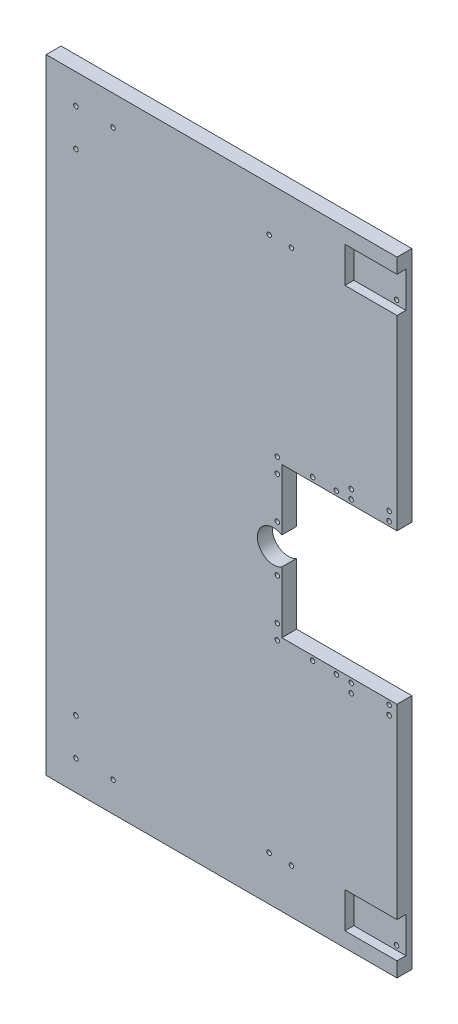
from build123d import *

# Parameters (mm, degrees)
EXTRUDE_1_DEPTH     = 10
SKETCH_2_R          = 1.5
CUT_EXTRUDE_1_DEPTH = 10
SKETCH_3_R          = 1.5
CUT_EXTRUDE_2_DEPTH = 10
SKETCH_4_R          = 1.5
CUT_EXTRUDE_3_DEPTH = 10
SKETCH_5_W          = 35
SKETCH_5_H          = 24
CUT_EXTRUDE_4_DEPTH = 6
SKETCH_6_R          = 1.5
CUT_EXTRUDE_5_DEPTH = 241.956427596


with BuildPart() as part:
    # 草图1 → 凸台-拉伸1 (new body)
    with BuildSketch(Plane.XY):
        with BuildLine():
            Line((118, 210), (-118, 210))
            Line((-118, 210), (-118, -210))
            Line((-118, -210), (118, -210))
            Line((118, -210), (118, -50.5))
            Line((118, -50.5), (40.5, -50.5))
            Line((40.5, -50.5), (40.5, -9.334147293))
            ThreePointArc((40.5, -9.334147293), (24.099506706, 0), (40.5, 9.334147293))
            Line((40.5, 9.334147293), (40.5, 50.5))
            Line((40.5, 50.5), (118, 50.5))
            Line((118, 50.5), (118, 210))
        make_face()
    extrude(amount=EXTRUDE_1_DEPTH)

    # 草图2 → 切除-拉伸1 (cut)
    with BuildSketch(Plane.XY.offset(10)):
        with Locations((-98, 165)):
            Circle(SKETCH_2_R)
        with Locations((-73, 190)):
            Circle(SKETCH_2_R)
        with Locations((-98, 190)):
            Circle(SKETCH_2_R)
    cut_extrude_1 = extrude(amount=-CUT_EXTRUDE_1_DEPTH, mode=Mode.SUBTRACT)

    # 草图3 → 切除-拉伸2 (cut)
    with BuildSketch(Plane.XY.offset(10)):
        with Locations((37.5, -15.672792958)):
            Circle(SKETCH_3_R)
        with Locations((112.73, -53.5)):
            Circle(SKETCH_3_R)
        with Locations((112.73, -59.5)):
            Circle(SKETCH_3_R)
        with Locations((87.23, -53.5)):
            Circle(SKETCH_3_R)
        with Locations((87.23, -59.5)):
            Circle(SKETCH_3_R)
        with Locations((77.23, -53.5)):
            Circle(SKETCH_3_R)
        with Locations((61.23, -53.5)):
            Circle(SKETCH_3_R)
        with Locations((37.5, -53.5)):
            Circle(SKETCH_3_R)
        with Locations((37.5, -43.5)):
            Circle(SKETCH_3_R)
    cut_extrude_2 = extrude(amount=-CUT_EXTRUDE_2_DEPTH, mode=Mode.SUBTRACT)

    # 镜向1: 切除-拉伸2 across plane
    add(cut_extrude_2.mirror(Plane.ZX), mode=Mode.SUBTRACT)

    # 镜向2: 切除-拉伸1 across plane
    add(cut_extrude_1.mirror(Plane.ZX), mode=Mode.SUBTRACT)

    # 草图4 → 切除-拉伸3 (cut)
    with BuildSketch(Plane.XY.offset(10)):
        with Locations((32, 180)):
            Circle(SKETCH_4_R)
        with Locations((47, 180)):
            Circle(SKETCH_4_R)
    cut_extrude_3 = extrude(amount=-CUT_EXTRUDE_3_DEPTH, mode=Mode.SUBTRACT)

    # 镜向3: 切除-拉伸3 across plane
    add(cut_extrude_3.mirror(Plane.ZX), mode=Mode.SUBTRACT)

    # 草图5 → 切除-拉伸4 (cut)
    with BuildSketch(Plane.XY.offset(10)):
        with Locations((100.5, -188)):
            Rectangle(SKETCH_5_W, SKETCH_5_H)
    cut_extrude_4 = extrude(amount=-CUT_EXTRUDE_4_DEPTH, mode=Mode.SUBTRACT)

    # 草图6 → 切除-拉伸5 (cut, through all)
    with BuildSketch(Plane.XY.offset(4)):
        with Locations((111.75, -179)):
            Circle(SKETCH_6_R)
        with Locations((111.75, -197)):
            Circle(SKETCH_6_R)
    cut_extrude_5 = extrude(amount=-CUT_EXTRUDE_5_DEPTH, mode=Mode.SUBTRACT)

    # 镜向4: 切除-拉伸4, 切除-拉伸5 across plane
    add(cut_extrude_4.mirror(Plane.ZX), mode=Mode.SUBTRACT)
    add(cut_extrude_5.mirror(Plane.ZX), mode=Mode.SUBTRACT)


solid = part.part
